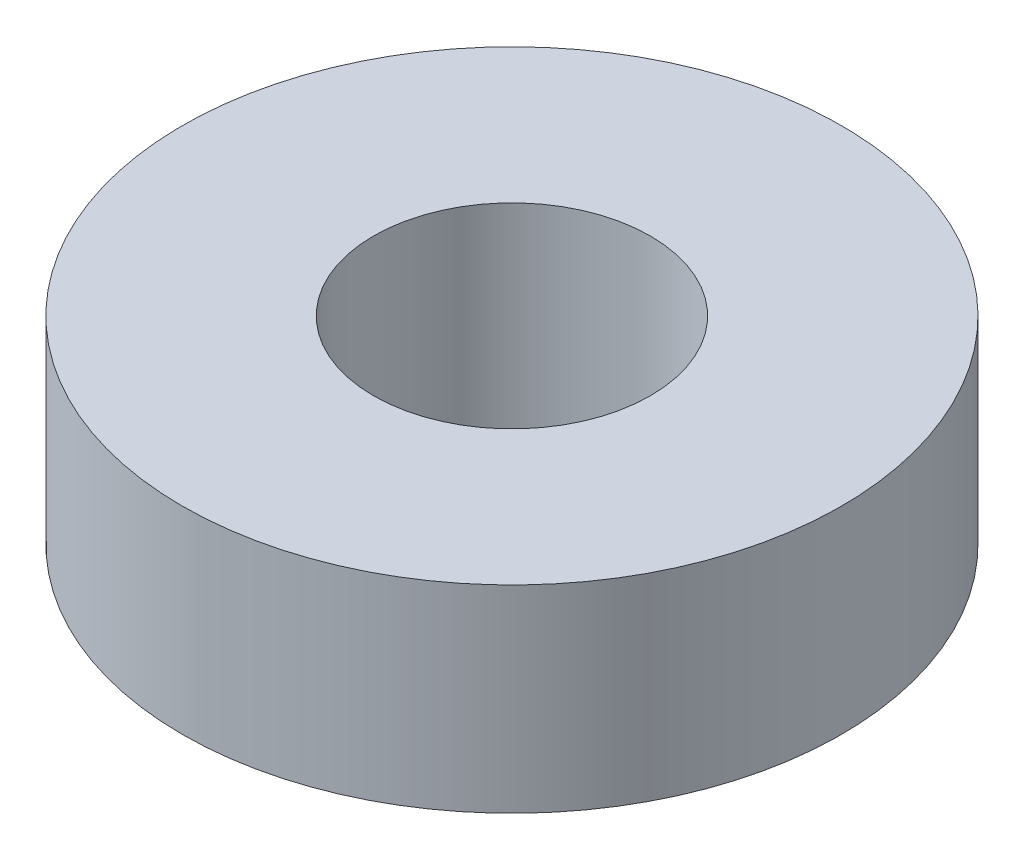
from build123d import *

# Parameters (mm, degrees)
SKETCH1_R           = 5
SKETCH1_R_2         = 2.1
BOSS_EXTRUDE1_DEPTH = 3


with BuildPart() as part:
    # Sketch1 → Boss-Extrude1 (new body)
    with BuildSketch(Plane(origin=(0, 0, 0), x_dir=(1, 0, 0), z_dir=(0, 1, 0))):
        with Locations(Location((0, 0, 0), (0, 0, 270))):
            Circle(SKETCH1_R)
        with Locations(Location((0, 0, 0), (0, 0, 270))):
            Circle(SKETCH1_R_2, mode=Mode.SUBTRACT)
    extrude(amount=BOSS_EXTRUDE1_DEPTH)


solid = part.part
